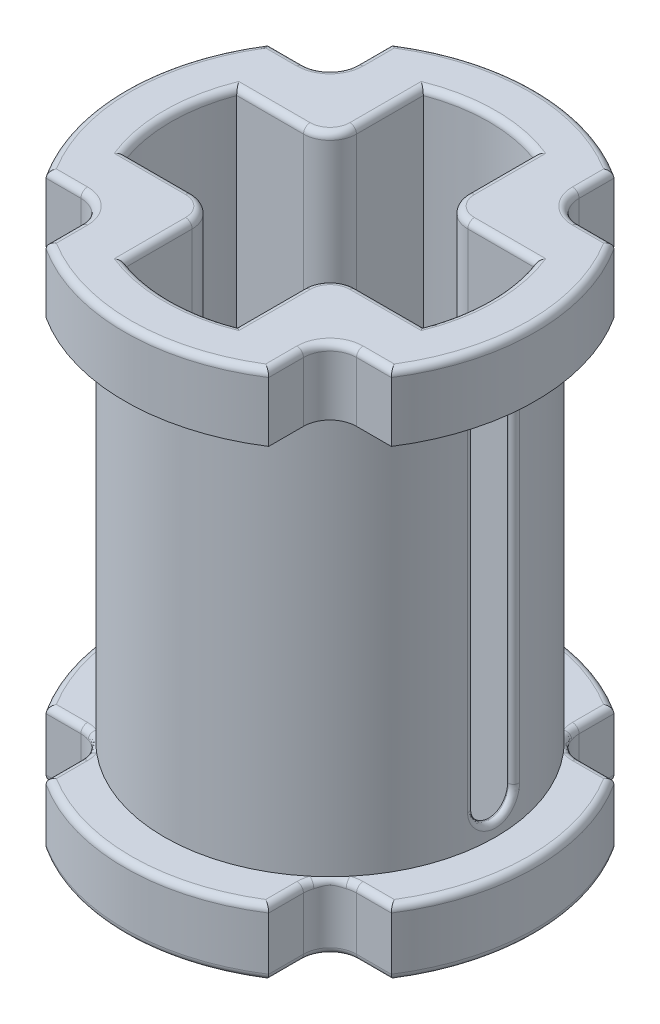
from build123d import *

# Parameters (mm, degrees)
SKETCH8_R               = 3.1
BOSS_EXTRUDE4_DEPTH     = 8
CUT_EXTRUDE1_DEPTH      = 10
CUT_EXTRUDE2_DEPTH      = 9
SKETCH13_R              = 3.1
SKETCH13_R_2            = 2.5
CUT_EXTRUDE4_DEPTH      = 3
FILLET1_R               = 0.1
FILLET2_R               = 0.1
CUT_EXTRUDE5_DEPTH      = 3
CUT_EXTRUDE5_DEPTH_BACK = 3
FILLET4_R               = 0.1
FILLET5_R               = 0.08


with BuildPart() as part:
    # Sketch8 → Boss-Extrude4 (new body)
    with BuildSketch(Plane(origin=(0, 0, 0), x_dir=(1, 0, 0), z_dir=(0, 1, 0))):
        with Locations(Location((0, 0, 0), (0, 0, 270))):
            Circle(SKETCH8_R)
    extrude(amount=BOSS_EXTRUDE4_DEPTH)

    # Sketch9 → Cut-Extrude1 (cut)
    with BuildSketch(Plane(origin=(0, 0, 0), x_dir=(1, 0, 0), z_dir=(0, 1, 0))):
        with BuildLine():
            Line((2.248199279, 0.84), (1.24, 0.84))
            ThreePointArc((1.24, 0.84), (0.957157288, 0.957157288), (0.84, 1.24))
            Line((0.84, 1.24), (0.84, 2.248199279))
            ThreePointArc((0.84, 2.248199279), (0, 2.4), (-0.84, 2.248199279))
            Line((-0.84, 2.248199279), (-0.84, 1.24))
            ThreePointArc((-0.84, 1.24), (-0.957157288, 0.957157288), (-1.24, 0.84))
            Line((-1.24, 0.84), (-2.248199279, 0.84))
            ThreePointArc((-2.248199279, 0.84), (-2.4, 0), (-2.248199279, -0.84))
            Line((-2.248199279, -0.84), (-1.24, -0.84))
            ThreePointArc((-1.24, -0.84), (-0.957157288, -0.957157288), (-0.84, -1.24))
            Line((-0.84, -1.24), (-0.84, -2.248199279))
            ThreePointArc((-0.84, -2.248199279), (0, -2.4), (0.84, -2.248199279))
            Line((0.84, -2.248199279), (0.84, -1.24))
            ThreePointArc((0.84, -1.24), (0.957157288, -0.957157288), (1.24, -0.84))
            Line((1.24, -0.84), (2.248199279, -0.84))
            ThreePointArc((2.248199279, -0.84), (2.361744934, -0.426803075), (2.4, 0))
            ThreePointArc((2.4, 0), (2.361744934, 0.426803075), (2.248199279, 0.84))
        make_face()
    extrude(amount=CUT_EXTRUDE1_DEPTH, mode=Mode.SUBTRACT)

    # Sketch10 → Cut-Extrude2 (cut)
    with BuildSketch(Plane.XZ):
        with BuildLine():
            Line((1.68, -2.08), (1.68, -2.605302286))
            ThreePointArc((1.68, -2.605302286), (2.192031022, -2.192031022), (2.605302286, -1.68))
            Line((2.605302286, -1.68), (2.08, -1.68))
            ThreePointArc((2.08, -1.68), (1.797157288, -1.797157288), (1.68, -2.08))
        make_face()
        with BuildLine():
            ThreePointArc((-1.68, -2.08), (-1.797157288, -1.797157288), (-2.08, -1.68))
            Line((-2.08, -1.68), (-2.605302286, -1.68))
            ThreePointArc((-2.605302286, -1.68), (-2.192031022, -2.192031022), (-1.68, -2.605302286))
            Line((-1.68, -2.605302286), (-1.68, -2.08))
        make_face()
        with BuildLine():
            ThreePointArc((-1.68, 2.605302286), (-2.192031022, 2.192031022), (-2.605302286, 1.68))
            Line((-2.605302286, 1.68), (-2.08, 1.68))
            ThreePointArc((-2.08, 1.68), (-1.797157288, 1.797157288), (-1.68, 2.08))
            Line((-1.68, 2.08), (-1.68, 2.605302286))
        make_face()
        with BuildLine():
            ThreePointArc((2.605302286, 1.68), (2.192031022, 2.192031022), (1.68, 2.605302286))
            Line((1.68, 2.605302286), (1.68, 2.08))
            ThreePointArc((1.68, 2.08), (1.797157288, 1.797157288), (2.08, 1.68))
            Line((2.08, 1.68), (2.605302286, 1.68))
        make_face()
    extrude(amount=-CUT_EXTRUDE2_DEPTH, mode=Mode.SUBTRACT)

    # Sketch13 → Cut-Extrude4 (cut, symmetric)
    with BuildSketch(Plane(origin=(0, 4, 0), x_dir=(1, 0, 0), z_dir=(0, 1, 0))):
        Circle(SKETCH13_R)
        with Locations(Location((0, 0, 0), (0, 0, 270))):
            Circle(SKETCH13_R_2, mode=Mode.SUBTRACT)
    extrude(amount=CUT_EXTRUDE4_DEPTH, both=True, mode=Mode.SUBTRACT)

    # Fillet1
    fillet1_edges = [part.edges().sort_by_distance(p)[0] for p in [
        (-2.342651143, 0, 1.68),
        (-1.797157288, 0, 1.797157288),
        (-1.68, 0, 2.342651143),
        (-1.797157288, 0, -1.797157288),
        (-2.342651143, 0, -1.68),
        (-1.68, 0, -2.342651143),
        (1.68, 0, -2.342651143),
        (2.342651143, 0, -1.68),
        (1.797157288, 0, -1.797157288),
        (-2.4, 0, 0),
        (-1.74409964, 0, 0.84),
        (-0.957157288, 0, 0.957157288),
        (-0.84, 0, 1.74409964),
        (0, 0, 2.4),
        (1.74409964, 0, 0.84),
        (2.4, 0, 0),
        (0.957157288, 0, -0.957157288),
        (0, 0, -2.4),
        (-0.84, 0, -1.74409964),
        (-0.957157288, 0, -0.957157288),
        (0.84, 0, -1.74409964),
        (1.74409964, 0, -0.84),
        (0.957157288, 0, 0.957157288),
        (0.84, 0, 1.74409964),
        (-1.74409964, 0, -0.84),
        (3.1, 0, 0),
        (0, 0, -3.1),
        (-3.1, 0, 0),
        (0, 0, 3.1),
        (1.68, 0, 2.342651143),
        (2.342651143, 0, 1.68),
        (1.797157288, 0, 1.797157288),
    ]]
    fillet(fillet1_edges, radius=FILLET1_R)

    # Fillet2
    fillet2_edges = [part.edges().sort_by_distance(p)[0] for p in [
        (-1.68, 8, 2.342651143),
        (-1.797157288, 8, 1.797157288),
        (-2.342651143, 8, 1.68),
        (-1.68, 8, -2.342651143),
        (-2.342651143, 8, -1.68),
        (-1.797157288, 8, -1.797157288),
        (2.342651143, 8, -1.68),
        (1.797157288, 8, -1.797157288),
        (1.68, 8, -2.342651143),
        (-0.957157288, 8, -0.957157288),
        (-1.74409964, 8, -0.84),
        (0.84, 8, 1.74409964),
        (0.957157288, 8, 0.957157288),
        (1.74409964, 8, -0.84),
        (0.84, 8, -1.74409964),
        (-2.4, 8, 0),
        (-1.74409964, 8, 0.84),
        (-0.957157288, 8, 0.957157288),
        (-0.84, 8, 1.74409964),
        (0, 8, 2.4),
        (1.74409964, 8, 0.84),
        (2.4, 8, 0),
        (0.957157288, 8, -0.957157288),
        (0, 8, -2.4),
        (-0.84, 8, -1.74409964),
        (3.1, 8, 0),
        (0, 8, -3.1),
        (-3.1, 8, 0),
        (0, 8, 3.1),
        (1.797157288, 8, 1.797157288),
        (1.68, 8, 2.342651143),
        (2.342651143, 8, 1.68),
    ]]
    fillet(fillet2_edges, radius=FILLET2_R)

    # Sketch15 → Cut-Extrude5 (cut, two sides: drawn at the far end of the back side and taken through both)
    with BuildSketch(Plane(origin=(0, 0, 0), x_dir=(0, 0, -1), z_dir=(1, 0, 0)).offset(-CUT_EXTRUDE5_DEPTH_BACK)):
        with BuildLine():
            Line((0.3, 6.5), (0.3, 1.5))
            ThreePointArc((0.3, 1.5), (0, 1.2), (-0.3, 1.5))
            Line((-0.3, 1.5), (-0.3, 6.5))
            ThreePointArc((-0.3, 6.5), (0, 6.8), (0.3, 6.5))
        make_face()
    extrude(amount=CUT_EXTRUDE5_DEPTH + CUT_EXTRUDE5_DEPTH_BACK, mode=Mode.SUBTRACT)

    # Fillet4
    fillet4_edges = [part.edges().sort_by_distance(p)[0] for p in [
        (1.797157288, 1, 1.797157288),
        (3.1, 1, 0),
        (0, 1, -3.1),
        (-3.1, 1, 0),
        (0, 1, 3.1),
        (2.342651143, 1, 1.68),
        (1.68, 1, 2.342651143),
        (-2.342651143, 1, 1.68),
        (-1.797157288, 1, -1.797157288),
        (1.68, 1, -2.342651143),
        (2.342651143, 1, -1.68),
        (1.797157288, 1, -1.797157288),
        (-1.797157288, 1, 1.797157288),
        (-1.68, 1, 2.342651143),
        (-1.68, 1, -2.342651143),
        (-2.342651143, 1, -1.68),
    ]]
    fillet(fillet4_edges, radius=FILLET4_R)

    # Fillet5
    fillet5_edges = [part.edges().sort_by_distance(p)[0] for p in [
        (-2.481934729, 4, 0.3),
        (-2.5, 1.2, 0),
        (-2.481934729, 4, -0.3),
        (-2.5, 6.8, 0),
        (2.481934729, 4, 0.3),
        (2.5, 1.2, 0),
        (2.481934729, 4, -0.3),
        (2.5, 6.8, 0),
    ]]
    fillet(fillet5_edges, radius=FILLET5_R)


solid = part.part
